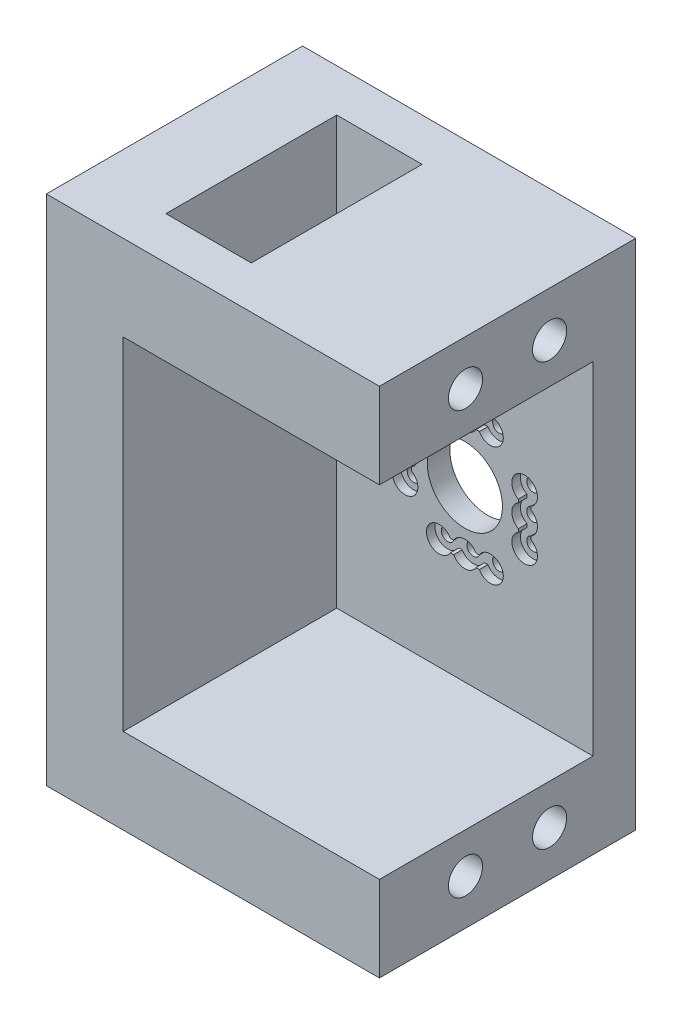
from build123d import *

# Parameters (mm, degrees)
SKETCH1_W           = 30
SKETCH1_H           = 60
BOSS_EXTRUDE1_DEPTH = 39
SKETCH2_W           = 20
SKETCH2_H           = 40
CUT_EXTRUDE1_DEPTH  = 30
SKETCH3_W           = 10
SKETCH3_H           = 20
CUT_EXTRUDE2_DEPTH  = 10
SKETCH4_R           = 2
CUT_EXTRUDE3_DEPTH  = 15
CUT_EXTRUDE4_START  = -2.65
SKETCH5_R           = 10.35
CUT_EXTRUDE4_DEPTH  = 2.35
SKETCH6_W           = 5
SKETCH6_H           = 40
CUT_EXTRUDE5_DEPTH  = 30
SKETCH7_R           = 4.4
CUT_EXTRUDE6_DEPTH  = 2.65
SKETCH8_R           = 0.75
CUT_EXTRUDE7_DEPTH  = 2.65
CUT_EXTRUDE10_DEPTH = 1


with BuildPart() as part:
    # Sketch1 → Boss-Extrude1 (new body)
    with BuildSketch(Plane(origin=(0, 0, 0), x_dir=(0, 0, -1), z_dir=(1, 0, 0))):
        Rectangle(SKETCH1_W, SKETCH1_H)
    extrude(amount=BOSS_EXTRUDE1_DEPTH)

    # Sketch2 → Cut-Extrude1 (cut)
    with BuildSketch(Plane(origin=(39, 0, 0), x_dir=(0, 0, -1), z_dir=(1, 0, 0))):
        Rectangle(SKETCH2_W, SKETCH2_H)
    extrude(amount=-CUT_EXTRUDE1_DEPTH, mode=Mode.SUBTRACT)

    # Sketch3 → Cut-Extrude2 (cut)
    with BuildSketch(Plane.XZ.offset(-20)):
        with Locations((14, 0)):
            Rectangle(SKETCH3_W, SKETCH3_H)
    extrude(amount=-CUT_EXTRUDE2_DEPTH, mode=Mode.SUBTRACT)

    # Sketch4 → Cut-Extrude3 (cut)
    with BuildSketch(Plane(origin=(39, 0, 0), x_dir=(0, 0, -1), z_dir=(1, 0, 0))):
        with Locations((4.925, 24.71)):
            Circle(SKETCH4_R)
        with Locations(Location((-4.925, 24.71, 0), (0, 0, 180))):
            Circle(SKETCH4_R)
        with Locations(Location((4.925, -24.71, 0), (0, 0, 180))):
            Circle(SKETCH4_R)
        with Locations((-4.925, -24.71)):
            Circle(SKETCH4_R)
    extrude(amount=-CUT_EXTRUDE3_DEPTH, mode=Mode.SUBTRACT)

    # Sketch5 → Cut-Extrude4 (cut)
    with BuildSketch(Plane.XY.offset(-10).offset(CUT_EXTRUDE4_START)):
        with Locations((24, 0)):
            Circle(SKETCH5_R)
    extrude(amount=-CUT_EXTRUDE4_DEPTH, mode=Mode.SUBTRACT)

    # Sketch6 → Cut-Extrude5 (cut)
    with BuildSketch(Plane(origin=(39, 0, 0), x_dir=(0, 0, -1), z_dir=(1, 0, 0))):
        with Locations((-12.5, 0)):
            Rectangle(SKETCH6_W, SKETCH6_H)
    extrude(amount=-CUT_EXTRUDE5_DEPTH, mode=Mode.SUBTRACT)

    # Sketch7 → Cut-Extrude6 (cut)
    with BuildSketch(Plane(origin=(0, 0, -12.65), x_dir=(-1, 0, 0), z_dir=(0, 0, -1))):
        with Locations((-24, 0)):
            Circle(SKETCH7_R)
    extrude(amount=-CUT_EXTRUDE6_DEPTH, mode=Mode.SUBTRACT)

    # Sketch8 → Cut-Extrude7 (cut)
    with BuildSketch(Plane.XY.offset(-10)):
        with Locations((24, 7)):
            Circle(SKETCH8_R)
        with Locations((27, 7)):
            Circle(SKETCH8_R)
        with Locations((21, 7)):
            Circle(SKETCH8_R)
        with Locations((31, 3)):
            Circle(SKETCH8_R)
        with Locations((31, 0)):
            Circle(SKETCH8_R)
        with Locations((31, -3)):
            Circle(SKETCH8_R)
        with Locations((27, -7)):
            Circle(SKETCH8_R)
        with Locations((24, -7)):
            Circle(SKETCH8_R)
        with Locations((21, -7)):
            Circle(SKETCH8_R)
        with Locations((17, -3)):
            Circle(SKETCH8_R)
        with Locations((17, 0)):
            Circle(SKETCH8_R)
        with Locations((17, 3)):
            Circle(SKETCH8_R)
    extrude(amount=-CUT_EXTRUDE7_DEPTH, mode=Mode.SUBTRACT)

    # Sketch9 → Cut-Extrude10 (cut)
    with BuildSketch(Plane.XY.offset(-10)):
        with BuildLine():
            Line((22.307419619, 7.735291737), (22.692580381, 7.735291737))
            ThreePointArc((22.692580381, 7.735291737), (24, 8.5), (25.307419619, 7.735291737))
            Line((25.307419619, 7.735291737), (25.692580381, 7.735291737))
            ThreePointArc((25.692580381, 7.735291737), (28.499997981, 7.002460845), (25.695, 6.260422418))
            Line((25.695, 6.260422418), (25.305, 6.260422418))
            ThreePointArc((25.305, 6.260422418), (24, 5.5), (22.695, 6.260422418))
            Line((22.695, 6.260422418), (22.305, 6.260422418))
            ThreePointArc((22.305, 6.260422418), (19.500002019, 7.002460845), (22.307419619, 7.735291737))
        make_face()
        with BuildLine():
            Line((30.260422418, 1.695), (30.260422418, 1.305))
            ThreePointArc((30.260422418, 1.305), (29.5, 0), (30.260422418, -1.305))
            Line((30.260422418, -1.305), (30.260422418, -1.695))
            ThreePointArc((30.260422418, -1.695), (31.002460845, -4.499997981), (31.735291737, -1.692580381))
            Line((31.735291737, -1.692580381), (31.735291737, -1.307419619))
            ThreePointArc((31.735291737, -1.307419619), (32.5, 0), (31.735291737, 1.307419619))
            Line((31.735291737, 1.307419619), (31.735291737, 1.692580381))
            ThreePointArc((31.735291737, 1.692580381), (31.002460845, 4.499997981), (30.260422418, 1.695))
        make_face()
        with BuildLine():
            Line((25.695, -6.260422418), (25.305, -6.260422418))
            ThreePointArc((25.305, -6.260422418), (24, -5.5), (22.695, -6.260422418))
            Line((22.695, -6.260422418), (22.305, -6.260422418))
            ThreePointArc((22.305, -6.260422418), (19.500002019, -7.002460845), (22.307419619, -7.735291737))
            Line((22.307419619, -7.735291737), (22.692580381, -7.735291737))
            ThreePointArc((22.692580381, -7.735291737), (24, -8.5), (25.307419619, -7.735291737))
            Line((25.307419619, -7.735291737), (25.692580381, -7.735291737))
            ThreePointArc((25.692580381, -7.735291737), (28.499997981, -7.002460845), (25.695, -6.260422418))
        make_face()
        with BuildLine():
            Line((17.739577582, -1.695), (17.739577582, -1.305))
            ThreePointArc((17.739577582, -1.305), (18.5, 0), (17.739577582, 1.305))
            Line((17.739577582, 1.305), (17.739577582, 1.695))
            ThreePointArc((17.739577582, 1.695), (16.997539155, 4.499997981), (16.264708263, 1.692580381))
            Line((16.264708263, 1.692580381), (16.264708263, 1.307419619))
            ThreePointArc((16.264708263, 1.307419619), (15.5, 0), (16.264708263, -1.307419619))
            Line((16.264708263, -1.307419619), (16.264708263, -1.692580381))
            ThreePointArc((16.264708263, -1.692580381), (16.997539155, -4.499997981), (17.739577582, -1.695))
        make_face()
    extrude(amount=-CUT_EXTRUDE10_DEPTH, mode=Mode.SUBTRACT)


solid = part.part
